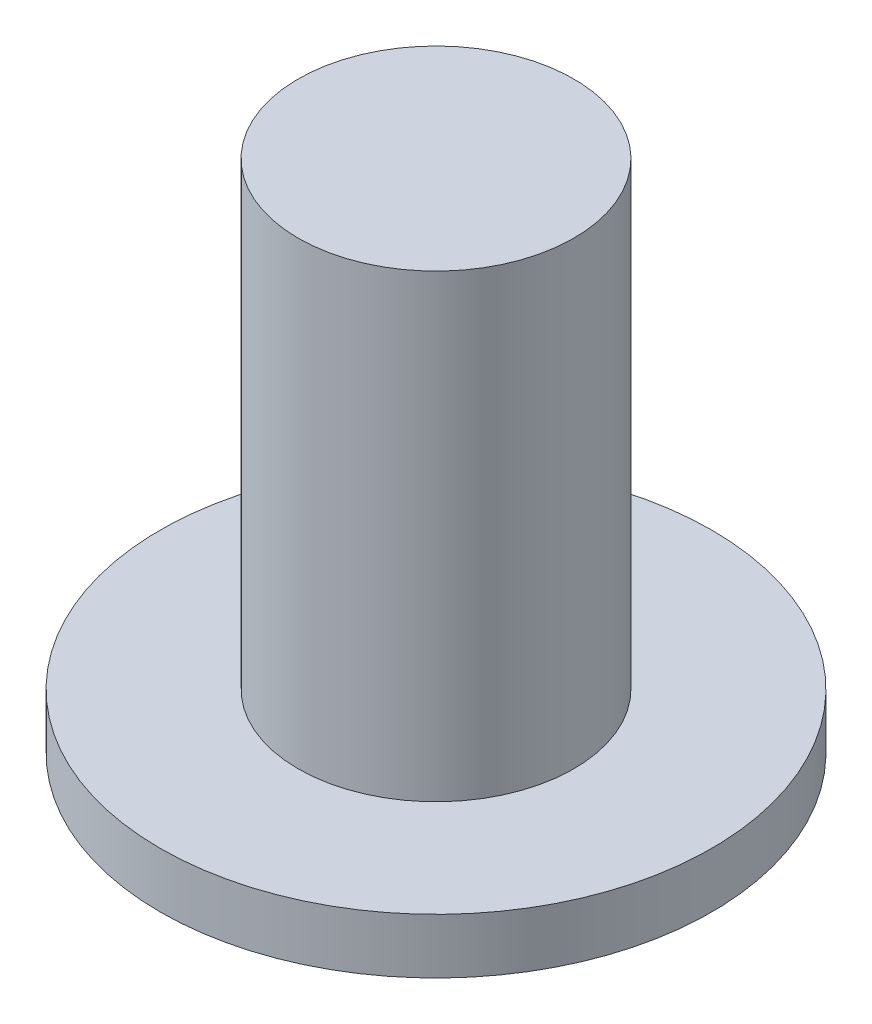
from build123d import *

# Parameters (mm, degrees)
SKETCH2_R           = 150
BOSS_EXTRUDE1_DEPTH = 30
SKETCH3_R           = 75
BOSS_EXTRUDE2_DEPTH = 250


with BuildPart() as part:
    # Sketch2 → Boss-Extrude1 (new body)
    with BuildSketch(Plane(origin=(0, 0, 0), x_dir=(1, 0, 0), z_dir=(0, 1, 0))):
        with Locations(Location((0, 0, 0), (0, 0, 270))):
            Circle(SKETCH2_R)
    extrude(amount=BOSS_EXTRUDE1_DEPTH)

    # Sketch3 → Boss-Extrude2 (add)
    with BuildSketch(Plane(origin=(0, 30, 0), x_dir=(1, 0, 0), z_dir=(0, 1, 0))):
        with Locations(Location((0, 0, 0), (0, 0, 270))):
            Circle(SKETCH3_R)
    extrude(amount=BOSS_EXTRUDE2_DEPTH)


solid = part.part
